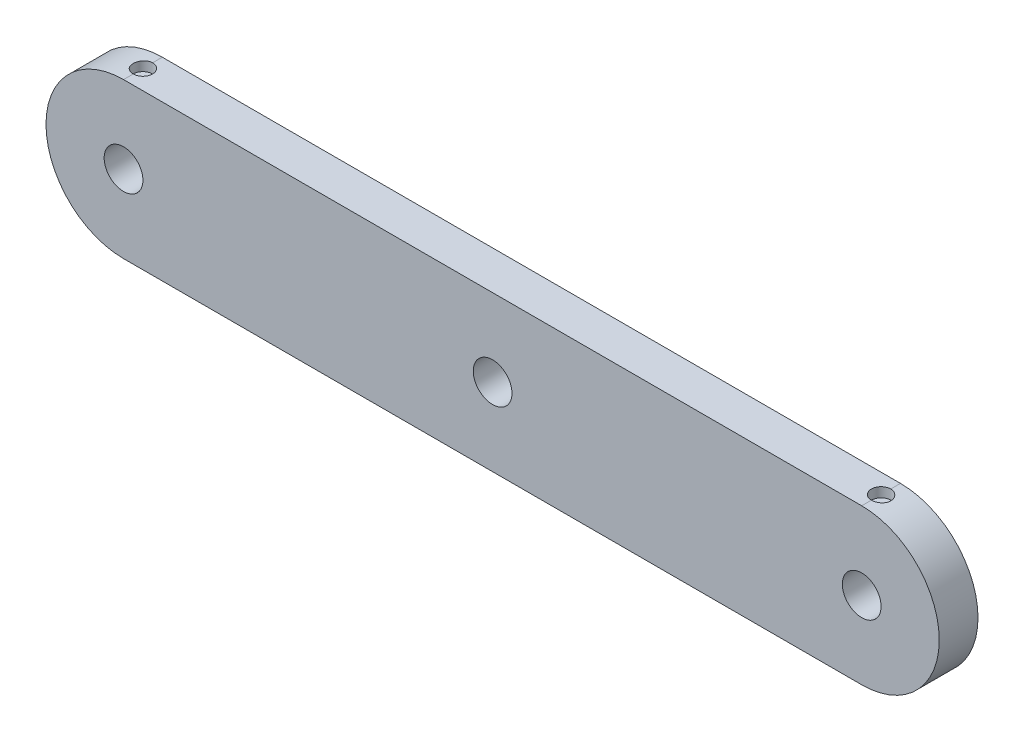
from build123d import *

# Parameters (mm, degrees)
SKETCH1_R           = 1
BOSS_EXTRUDE1_DEPTH = 2
SKETCH2_R           = 0.5
CUT_EXTRUDE1_DEPTH  = 0.5
SKETCH3_R           = 0.5
CUT_EXTRUDE2_DEPTH  = 0.5


with BuildPart() as part:
    # Sketch1 → Boss-Extrude1 (new body)
    with BuildSketch(Plane.XY):
        with BuildLine():
            Line((-19.041986571, 4), (19.041986571, 4))
            ThreePointArc((19.041986571, 4), (23.041986571, 0), (19.041986571, -4))
            Line((19.041986571, -4), (-19.041986571, -4))
            ThreePointArc((-19.041986571, -4), (-23.041986571, 0), (-19.041986571, 4))
        make_face()
        Circle(SKETCH1_R, mode=Mode.SUBTRACT)
        with Locations((19.041986571, 0)):
            Circle(SKETCH1_R, mode=Mode.SUBTRACT)
        with Locations((-19.041986571, 0)):
            Circle(SKETCH1_R, mode=Mode.SUBTRACT)
    extrude(amount=BOSS_EXTRUDE1_DEPTH)

    # Sketch2 → Cut-Extrude1 (cut)
    with BuildSketch(Plane(origin=(0, 4, 0), x_dir=(1, 0, 0), z_dir=(0, 1, 0))):
        with Locations(Location((-19.041986571, -1, 0), (0, 0, 270))):
            Circle(SKETCH2_R)
        with Locations(Location((19.041986571, -1, 0), (0, 0, 90))):
            Circle(SKETCH2_R)
    extrude(amount=-CUT_EXTRUDE1_DEPTH, mode=Mode.SUBTRACT)

    # Sketch3 → Cut-Extrude2 (cut)
    with BuildSketch(Plane.XZ.offset(4)):
        with Locations(Location((0, 1, 0), (0, 0, 270))):
            Circle(SKETCH3_R)
    extrude(amount=-CUT_EXTRUDE2_DEPTH, mode=Mode.SUBTRACT)


solid = part.part
